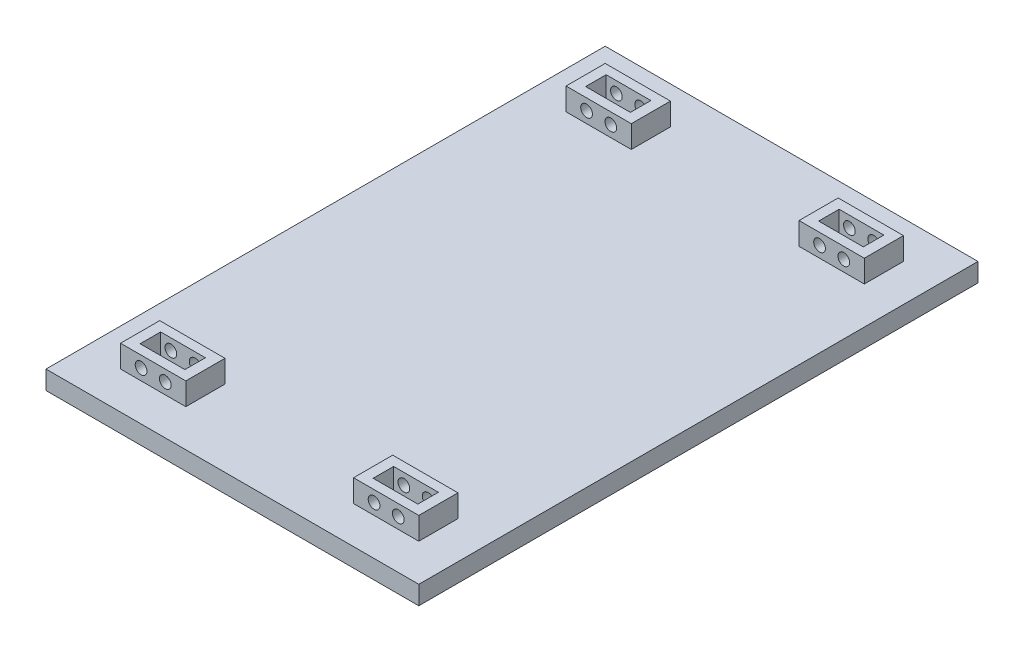
from build123d import *

# Parameters (mm, degrees)
SKETCH1_W           = 200
SKETCH1_H           = 300
BOSS_EXTRUDE1_DEPTH = 10
SKETCH2_W           = 35
SKETCH2_H           = 21
SKETCH2_W_2         = 24
SKETCH2_H_2         = 11
BOSS_EXTRUDE2_DEPTH = 12
SKETCH3_R           = 3.14
CUT_EXTRUDE1_DEPTH  = 1200


with BuildPart() as part:
    # Sketch1 → Boss-Extrude1 (new body)
    with BuildSketch(Plane(origin=(0, 0, 0), x_dir=(1, 0, 0), z_dir=(0, 1, 0))):
        with Locations((83.100354765, 144.618140233)):
            Rectangle(SKETCH1_W, SKETCH1_H)
    extrude(amount=BOSS_EXTRUDE1_DEPTH)

    # Sketch2 → Boss-Extrude2 (add)
    # profile 1 of 4: a face of its own
    with BuildSketch(Plane(origin=(0, 10, 0), x_dir=(1, 0, 0), z_dir=(0, 1, 0))):
        with Locations((20.600354765, 25.118140233)):
            Rectangle(SKETCH2_W, SKETCH2_H)
        with Locations((20.600354765, 25.118140233)):
            Rectangle(SKETCH2_W_2, SKETCH2_H_2, mode=Mode.SUBTRACT)
    # profile 2 of 4: a face of its own
    with BuildSketch(Plane(origin=(0, 10, 0), x_dir=(1, 0, 0), z_dir=(0, 1, 0))):
        with Locations((145.600354765, 25.118140233)):
            Rectangle(SKETCH2_W, SKETCH2_H)
        with Locations((145.600354765, 25.118140233)):
            Rectangle(SKETCH2_W_2, SKETCH2_H_2, mode=Mode.SUBTRACT)
    # profile 3 of 4: a face of its own
    with BuildSketch(Plane(origin=(0, 10, 0), x_dir=(1, 0, 0), z_dir=(0, 1, 0))):
        with Locations((145.600354765, 264.118140233)):
            Rectangle(SKETCH2_W, SKETCH2_H)
        with Locations((145.600354765, 264.118140233)):
            Rectangle(SKETCH2_W_2, SKETCH2_H_2, mode=Mode.SUBTRACT)
    # profile 4 of 4: a face of its own
    with BuildSketch(Plane(origin=(0, 10, 0), x_dir=(1, 0, 0), z_dir=(0, 1, 0))):
        with Locations((20.600354765, 264.118140233)):
            Rectangle(SKETCH2_W, SKETCH2_H)
        with Locations((20.600354765, 264.118140233)):
            Rectangle(SKETCH2_W_2, SKETCH2_H_2, mode=Mode.SUBTRACT)
    extrude(amount=BOSS_EXTRUDE2_DEPTH)

    # Sketch3 → Cut-Extrude1 (cut)
    with BuildSketch(Plane.XY.offset(5.381859767)):
        with Locations(Location((14.100354765, 16, 0), (0, 0, 180))):
            Circle(SKETCH3_R)
        with Locations(Location((27.100354765, 16, 0), (0, 0, 180))):
            Circle(SKETCH3_R)
        with Locations((152.100354765, 16)):
            Circle(SKETCH3_R)
        with Locations((139.100354765, 16)):
            Circle(SKETCH3_R)
    extrude(amount=-CUT_EXTRUDE1_DEPTH, mode=Mode.SUBTRACT)


solid = part.part
